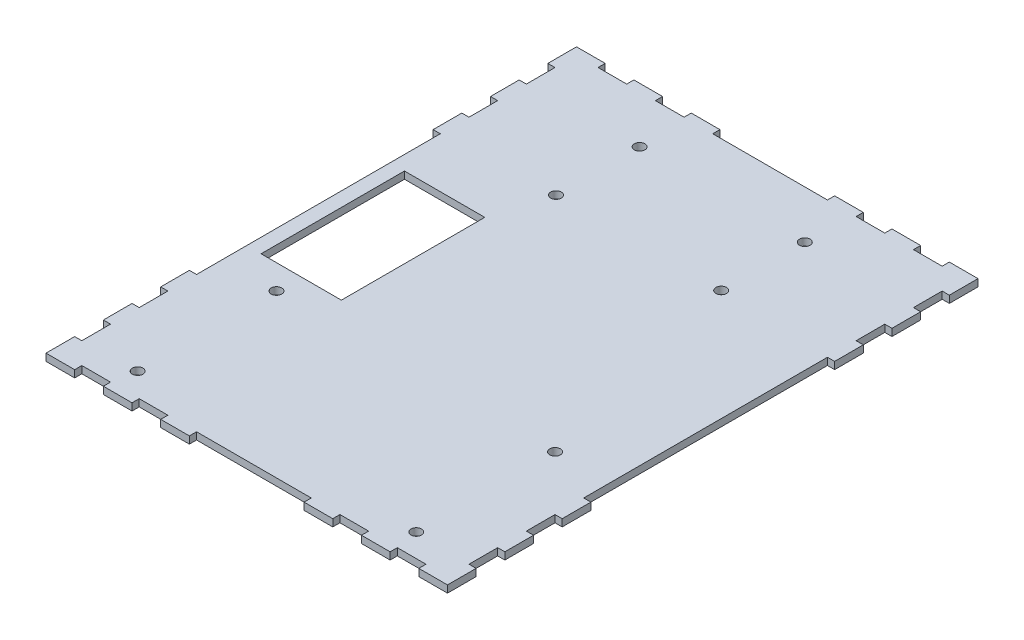
from build123d import *

# Parameters (mm, degrees)
BOSS_EXTRUDE1_DEPTH = 3.175
SKETCH5_W           = 12.7
SKETCH5_H           = 3.175
SKETCH5_W_2         = 25.4
CUT_EXTRUDE4_DEPTH  = 7.62
SKETCH7_W           = 35.56
SKETCH7_H           = 63.5
CUT_EXTRUDE5_DEPTH  = 7.62
CUT_EXTRUDE6_DEPTH  = 7.62
SKETCH9_R           = 2.3495
CUT_EXTRUDE7_DEPTH  = 25.4


with BuildPart() as part:
    # Sketch1 → Boss-Extrude1 (new body)
    with BuildSketch(Plane(origin=(0, 0, 0), x_dir=(1, 0, 0), z_dir=(0, 1, 0))):
        Polygon((3.175, 209.55), (0, 209.55), (0, 196.85), (3.175, 196.85), (3.175, 184.15), (0, 184.15), (0, 171.45), (3.175, 171.45), (3.175, 63.5), (0, 63.5), (0, 50.8), (3.175, 50.8), (3.175, 38.1), (0, 38.1), (0, 25.4), (3.175, 25.4), (3.175, 12.7), (0, 12.7), (0, 0), (177.8, 0), (177.8, 12.7), (174.625, 12.7), (174.625, 25.4), (177.8, 25.4), (177.8, 38.1), (174.625, 38.1), (174.625, 50.8), (177.8, 50.8), (177.8, 63.5), (174.625, 63.5), (174.625, 171.45), (177.8, 171.45), (177.8, 184.15), (174.625, 184.15), (174.625, 196.85), (177.8, 196.85), (177.8, 209.55), (174.625, 209.55), (174.625, 222.25), (177.8, 222.25), (177.8, 234.95), (0, 234.95), (0, 222.25), (3.175, 222.25), align=None)
    extrude(amount=BOSS_EXTRUDE1_DEPTH)

    # Sketch5 → Cut-Extrude4 (cut)
    with BuildSketch(Plane(origin=(0, 3.175, 0), x_dir=(1, 0, 0), z_dir=(0, 1, 0))):
        with Locations((19.05, 1.5875)):
            Rectangle(SKETCH5_W, SKETCH5_H)
        with Locations((44.45, 1.5875)):
            Rectangle(SKETCH5_W, SKETCH5_H)
        with Locations((76.2, 1.5875)):
            Rectangle(SKETCH5_W_2, SKETCH5_H)
        with Locations((101.6, 1.5875)):
            Rectangle(SKETCH5_W_2, SKETCH5_H)
        with Locations((133.35, 1.5875)):
            Rectangle(SKETCH5_W, SKETCH5_H)
        with Locations((158.75, 1.5875)):
            Rectangle(SKETCH5_W, SKETCH5_H)
    cut_extrude4 = extrude(amount=-CUT_EXTRUDE4_DEPTH, mode=Mode.SUBTRACT)

    # Mirror1: Cut-Extrude4 across plane
    add(cut_extrude4.mirror(Plane.XY.offset(-117.475)), mode=Mode.SUBTRACT)

    # Sketch7 → Cut-Extrude5 (cut)
    with BuildSketch(Plane(origin=(0, 3.175, 0), x_dir=(1, 0, 0), z_dir=(0, 1, 0))):
        with Locations((27.305, 117.475)):
            Rectangle(SKETCH7_W, SKETCH7_H)
    extrude(amount=-CUT_EXTRUDE5_DEPTH, mode=Mode.SUBTRACT)

    # Sketch8 → Cut-Extrude6 (cut)
    with BuildSketch(Plane(origin=(0, 3.175, 0), x_dir=(1, 0, 0), z_dir=(0, 1, 0))):
        with BuildLine():
            ThreePointArc((24.859449392, 13.37707256), (25.54760201, 11.715725178), (27.208949392, 11.02757256))
            Line((27.208949392, 11.02757256), (27.208949392, 13.37707256))
            Line((27.208949392, 13.37707256), (24.859449392, 13.37707256))
        make_face()
        with BuildLine():
            ThreePointArc((27.208949392, 15.72657256), (25.54760201, 15.038419942), (24.859449392, 13.37707256))
            Line((24.859449392, 13.37707256), (27.208949392, 13.37707256))
            Line((27.208949392, 13.37707256), (27.208949392, 15.72657256))
        make_face()
        with BuildLine():
            Line((27.208949392, 15.72657256), (27.208949392, 13.37707256))
            Line((27.208949392, 13.37707256), (29.558449392, 13.37707256))
            ThreePointArc((29.558449392, 13.37707256), (28.870296774, 15.038419942), (27.208949392, 15.72657256))
        make_face()
        with BuildLine():
            Line((27.208949392, 13.37707256), (27.208949392, 11.02757256))
            ThreePointArc((27.208949392, 11.02757256), (28.870296774, 11.715725178), (29.558449392, 13.37707256))
            Line((29.558449392, 13.37707256), (27.208949392, 13.37707256))
        make_face()
        with BuildLine():
            ThreePointArc((29.558449392, 74.849360588), (25.54760201, 76.51070797), (27.208949392, 72.499860588))
            Line((27.208949392, 72.499860588), (27.208949392, 74.849360588))
            Line((27.208949392, 74.849360588), (29.558449392, 74.849360588))
        make_face()
        with BuildLine():
            Line((27.208949392, 74.849360588), (27.208949392, 72.499860588))
            ThreePointArc((27.208949392, 72.499860588), (28.870296774, 73.188013206), (29.558449392, 74.849360588))
            Line((29.558449392, 74.849360588), (27.208949392, 74.849360588))
        make_face()
        with BuildLine():
            ThreePointArc((148.241550608, 74.849360588), (148.929703226, 73.188013206), (150.591050608, 72.499860588))
            Line((150.591050608, 72.499860588), (150.591050608, 74.849360588))
            Line((150.591050608, 74.849360588), (148.241550608, 74.849360588))
        make_face()
        with BuildLine():
            Line((150.591050608, 74.849360588), (150.591050608, 72.499860588))
            ThreePointArc((150.591050608, 72.499860588), (152.25239799, 73.188013206), (152.940550608, 74.849360588))
            ThreePointArc((152.940550608, 74.849360588), (150.591050608, 77.198860588), (148.241550608, 74.849360588))
            Line((148.241550608, 74.849360588), (150.591050608, 74.849360588))
        make_face()
        with BuildLine():
            ThreePointArc((150.591050608, 15.72657256), (148.929703226, 15.038419942), (148.241550608, 13.37707256))
            Line((148.241550608, 13.37707256), (150.591050608, 13.37707256))
            Line((150.591050608, 13.37707256), (150.591050608, 15.72657256))
        make_face()
        with BuildLine():
            Line((150.591050608, 13.37707256), (148.241550608, 13.37707256))
            ThreePointArc((148.241550608, 13.37707256), (150.591050608, 11.02757256), (152.940550608, 13.37707256))
            ThreePointArc((152.940550608, 13.37707256), (152.25239799, 15.038419942), (150.591050608, 15.72657256))
            Line((150.591050608, 15.72657256), (150.591050608, 13.37707256))
        make_face()
    extrude(amount=-CUT_EXTRUDE6_DEPTH, mode=Mode.SUBTRACT)

    # Sketch9 → Cut-Extrude7 (cut)
    with BuildSketch(Plane(origin=(0, 3.175, 0), x_dir=(1, 0, 0), z_dir=(0, 1, 0))):
        with Locations(Location((52.32122124, 210.560282968, 0), (0, 0, 270))):
            Circle(SKETCH9_R)
        with Locations(Location((52.32122124, 173.54571463, 0), (0, 0, 270))):
            Circle(SKETCH9_R)
        with Locations(Location((125.47877876, 173.54571463, 0), (0, 0, 270))):
            Circle(SKETCH9_R)
        with Locations(Location((125.47877876, 210.560282968, 0), (0, 0, 270))):
            Circle(SKETCH9_R)
    extrude(amount=-CUT_EXTRUDE7_DEPTH, mode=Mode.SUBTRACT)


solid = part.part
